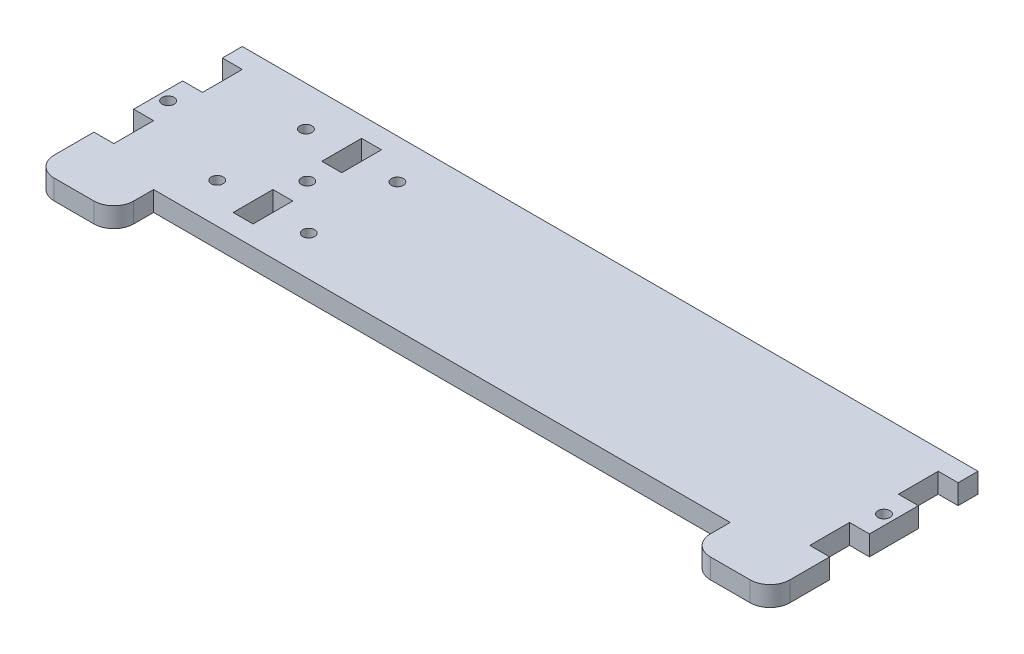
from build123d import *

# Parameters (mm, degrees)
SKETCH_1_R      = 1.5
SKETCH_1_W      = 5
SKETCH_1_H      = 10
EXTRUDE_1_DEPTH = 5


with BuildPart() as part:
    # 草图1 → 凸台-拉伸1 (new body)
    with BuildSketch(Plane(origin=(0, 0, 0), x_dir=(1, 0, 0), z_dir=(0, 1, 0))):
        with BuildLine():
            Line((0, 0), (0, -5))
            ThreePointArc((0, -5), (1.464466094, -8.535533906), (5, -10))
            Line((5, -10), (15, -10))
            ThreePointArc((15, -10), (18.535533906, -8.535533906), (20, -5))
            Line((20, -5), (20, 0))
            Line((20, 0), (165, 0))
            Line((165, 0), (165, -5))
            ThreePointArc((165, -5), (166.464466094, -8.535533906), (170, -10))
            Line((170, -10), (180, -10))
            ThreePointArc((180, -10), (183.535533906, -8.535533906), (185, -5))
            Line((185, -5), (185, 0))
            Line((185, 0), (185, 5))
            Line((185, 5), (180, 5))
            Line((180, 5), (180, 15))
            Line((180, 15), (185, 15))
            Line((185, 15), (185, 27.3))
            Line((185, 27.3), (180, 27.3))
            Line((180, 27.3), (180, 37.3))
            Line((180, 37.3), (185, 37.3))
            Line((185, 37.3), (185, 42.3))
            Line((185, 42.3), (0, 42.3))
            Line((0, 42.3), (0, 37.3))
            Line((0, 37.3), (5, 37.3))
            Line((5, 37.3), (5, 27.3))
            Line((5, 27.3), (0, 27.3))
            Line((0, 27.3), (0, 15))
            Line((0, 15), (5, 15))
            Line((5, 15), (5, 5))
            Line((5, 5), (0, 5))
            Line((0, 5), (0, 0))
        make_face()
        with Locations(Location((26, 32.3, 0), (0, 0, 270))):
            Circle(SKETCH_1_R, mode=Mode.SUBTRACT)
        with Locations(Location((49, 32.3, 0), (0, 0, 270))):
            Circle(SKETCH_1_R, mode=Mode.SUBTRACT)
        with Locations(Location((26, 10, 0), (0, 0, 270))):
            Circle(SKETCH_1_R, mode=Mode.SUBTRACT)
        with Locations(Location((49, 10, 0), (0, 0, 270))):
            Circle(SKETCH_1_R, mode=Mode.SUBTRACT)
        with Locations(Location((2.5, 21.15, 0), (0, 0, 270))):
            Circle(SKETCH_1_R, mode=Mode.SUBTRACT)
        with Locations(Location((182.5, 21.15, 0), (0, 0, 270))):
            Circle(SKETCH_1_R, mode=Mode.SUBTRACT)
        with Locations(Location((37.5, 21.15, 0), (0, 0, 270))):
            Circle(SKETCH_1_R, mode=Mode.SUBTRACT)
        with Locations((37.5, 32.3)):
            Rectangle(SKETCH_1_W, SKETCH_1_H, mode=Mode.SUBTRACT)
        with Locations((37.5, 10)):
            Rectangle(SKETCH_1_W, SKETCH_1_H, mode=Mode.SUBTRACT)
    extrude(amount=EXTRUDE_1_DEPTH)


solid = part.part
